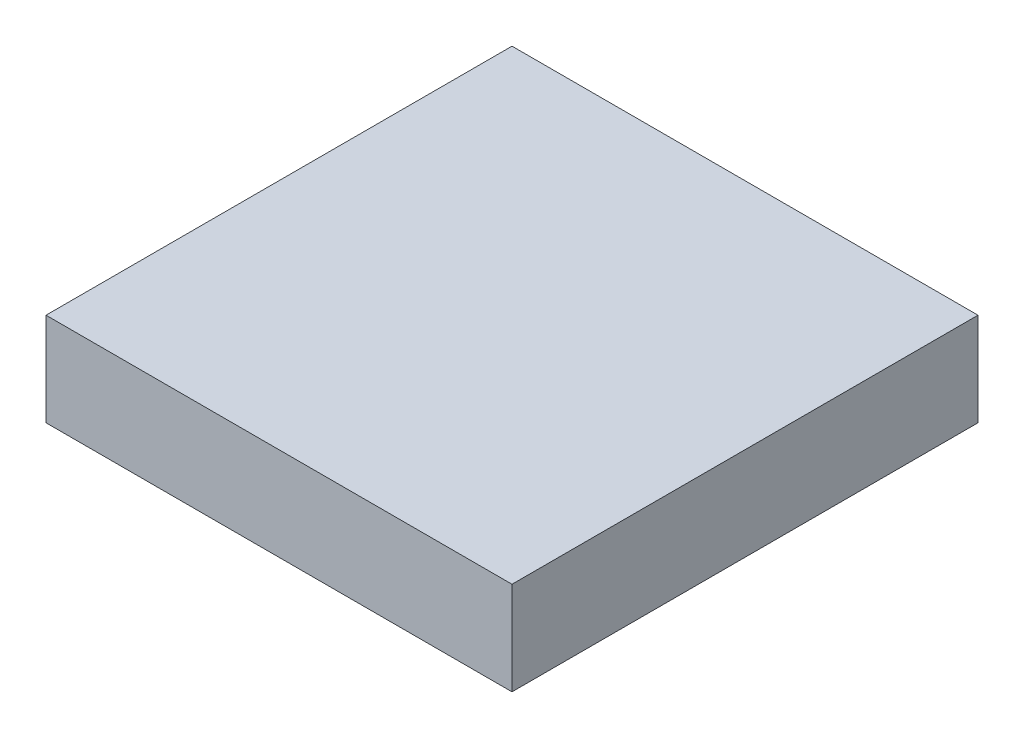
from build123d import *

# Parameters (mm, degrees)
SKETCH1_W           = 35
SKETCH1_H           = 35
BOSS_EXTRUDE1_DEPTH = 7


with BuildPart() as part:
    # Sketch1 → Boss-Extrude1 (new body)
    with BuildSketch(Plane(origin=(0, 0, 0), x_dir=(1, 0, 0), z_dir=(0, 1, 0))):
        with Locations((17.5, 17.5)):
            Rectangle(SKETCH1_W, SKETCH1_H)
    extrude(amount=BOSS_EXTRUDE1_DEPTH)


solid = part.part
